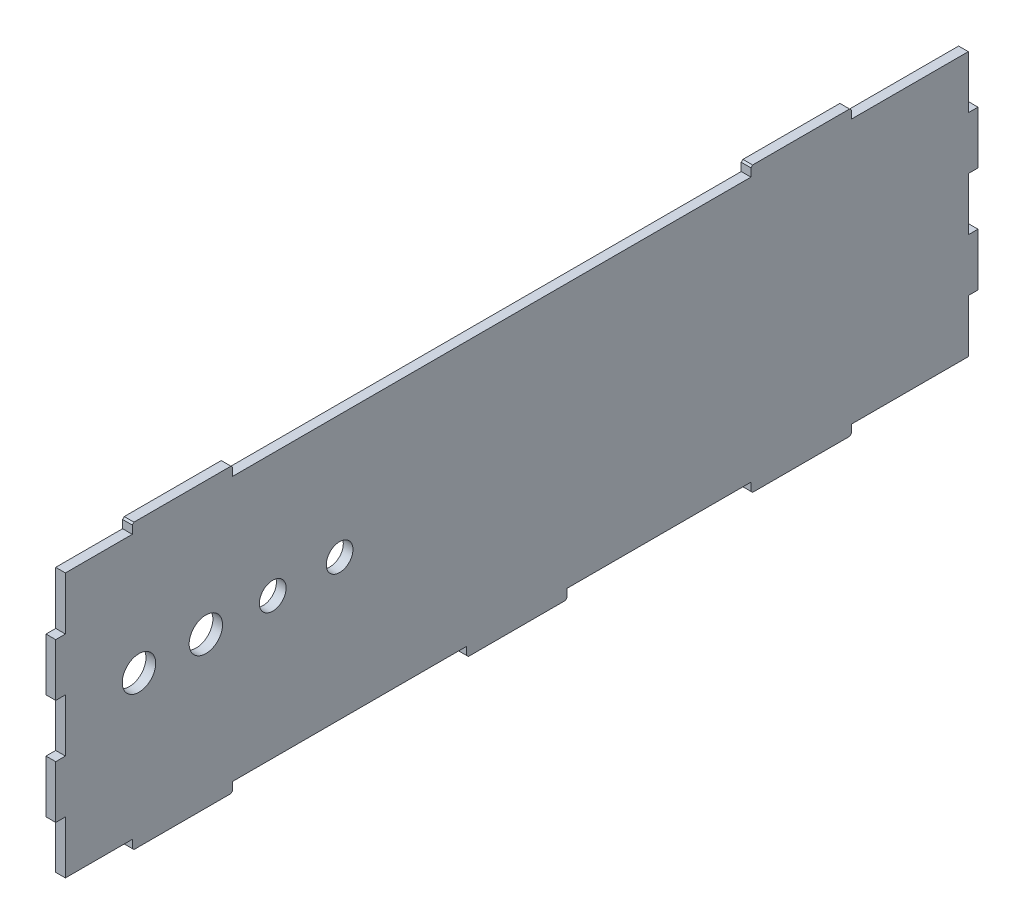
from build123d import *

# Parameters (mm, degrees)
SKETCH1_R           = 5
SKETCH1_R_2         = 4
BOSS_EXTRUDE1_DEPTH = 2.9


with BuildPart() as part:
    # Sketch1 → Boss-Extrude1 (new body)
    with BuildSketch(Plane(origin=(116, 0, 0), x_dir=(0, 0, -1), z_dir=(1, 0, 0))):
        Polygon((-135, 2.9), (-115, 2.9), (-115, 0.5), (-114.5, 0), (-85.5, 0), (-85, 0.5), (-85, 2.9), (-15, 2.9), (-15, 0.5), (-14.5, 0), (14.5, 0), (15, 0.5), (15, 2.9), (70, 2.9), (70, 0.5), (70.5, 0), (99.5, 0), (100, 0.5), (100, 2.9), (135, 2.9), (135, 18.725), (137.9, 18.725), (137.9, 34.475), (135, 34.475), (135, 50.325), (137.9, 50.325), (137.9, 66.075), (135, 66.075), (135, 81.9), (100, 81.9), (100, 84.3), (99.5, 84.8), (70.5, 84.8), (70, 84.3), (70, 81.9), (-85, 81.9), (-85, 84.3), (-85.5, 84.8), (-114.5, 84.8), (-115, 84.3), (-115, 81.9), (-135, 81.9), (-135, 66.075), (-137.9, 66.075), (-137.9, 50.325), (-135, 50.325), (-135, 34.475), (-137.9, 34.475), (-137.9, 18.725), (-135, 18.725), align=None)
        with Locations((-113, 45)):
            Circle(SKETCH1_R, mode=Mode.SUBTRACT)
        with Locations((-93, 45)):
            Circle(SKETCH1_R, mode=Mode.SUBTRACT)
        with Locations((-73, 45)):
            Circle(SKETCH1_R_2, mode=Mode.SUBTRACT)
        with Locations((-53, 45)):
            Circle(SKETCH1_R_2, mode=Mode.SUBTRACT)
    extrude(amount=BOSS_EXTRUDE1_DEPTH)


solid = part.part
